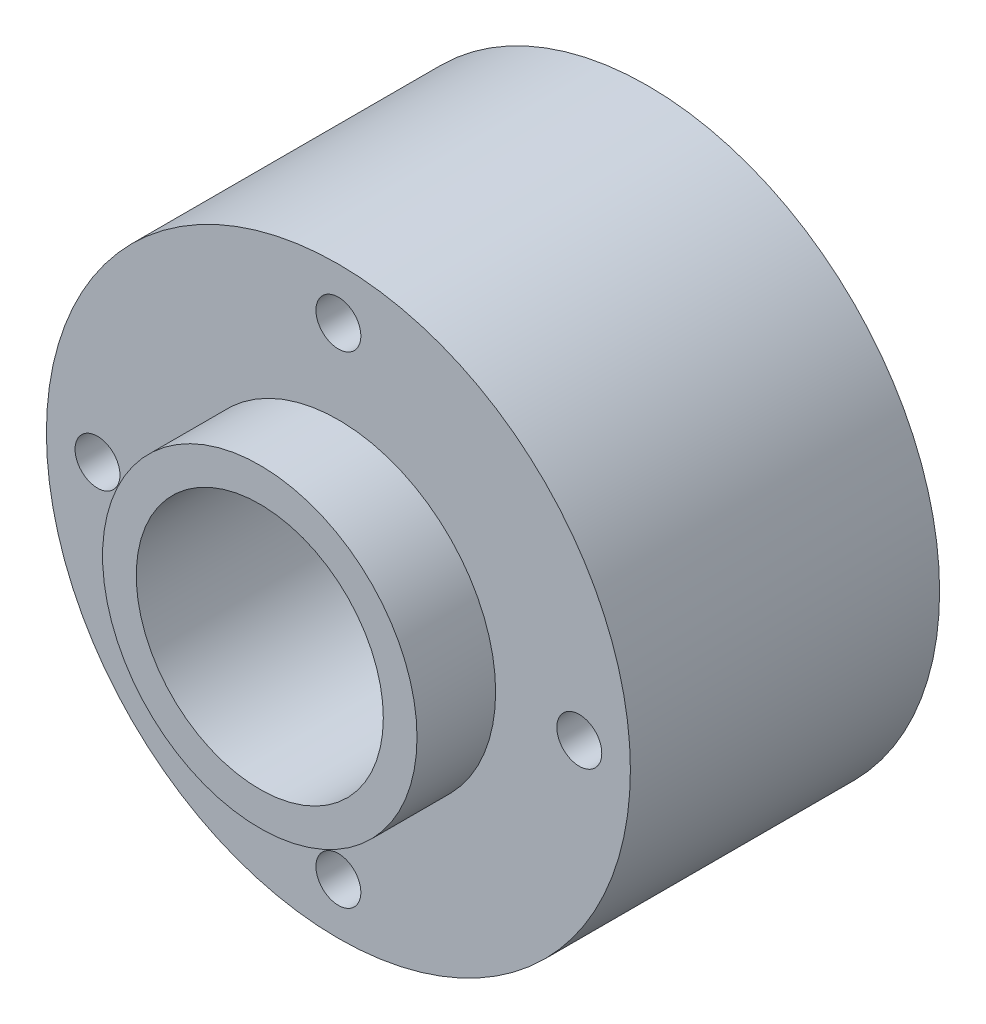
from build123d import *

# Parameters (mm, degrees)
BOSS_EXTRUDE1_START      = -4.5
SKETCH1_R                = 26
SKETCH1_R_2              = 2
SKETCH1_R_3              = 14
BOSS_EXTRUDE1_DEPTH      = 27.531540746
BOSS_EXTRUDE2_DEPTH      = 7
BOSS_EXTRUDE2_DEPTH_BACK = 34
SKETCH3_R                = 14
SKETCH3_R_2              = 11


with BuildPart() as part:
    # Sketch1 → Boss-Extrude1 (new body)
    with BuildSketch(Plane.XY.offset(BOSS_EXTRUDE1_START)):
        Circle(SKETCH1_R)
        with Locations((21.45, 0)):
            Circle(SKETCH1_R_2, mode=Mode.SUBTRACT)
        with Locations((0, -21.45)):
            Circle(SKETCH1_R_2, mode=Mode.SUBTRACT)
        Circle(SKETCH1_R_3, mode=Mode.SUBTRACT)
        with Locations((-21.45, 0)):
            Circle(SKETCH1_R_2, mode=Mode.SUBTRACT)
        with Locations((0, 21.45)):
            Circle(SKETCH1_R_2, mode=Mode.SUBTRACT)
    extrude(amount=-BOSS_EXTRUDE1_DEPTH)

    # Sketch3 → Boss-Extrude2 (add, two sides: drawn at the far end of the back side and taken through both)
    with BuildSketch(Plane.XY.offset(-4.5).offset(-BOSS_EXTRUDE2_DEPTH_BACK)):
        Circle(SKETCH3_R)
        Circle(SKETCH3_R_2, mode=Mode.SUBTRACT)
    extrude(amount=BOSS_EXTRUDE2_DEPTH + BOSS_EXTRUDE2_DEPTH_BACK)


solid = part.part
